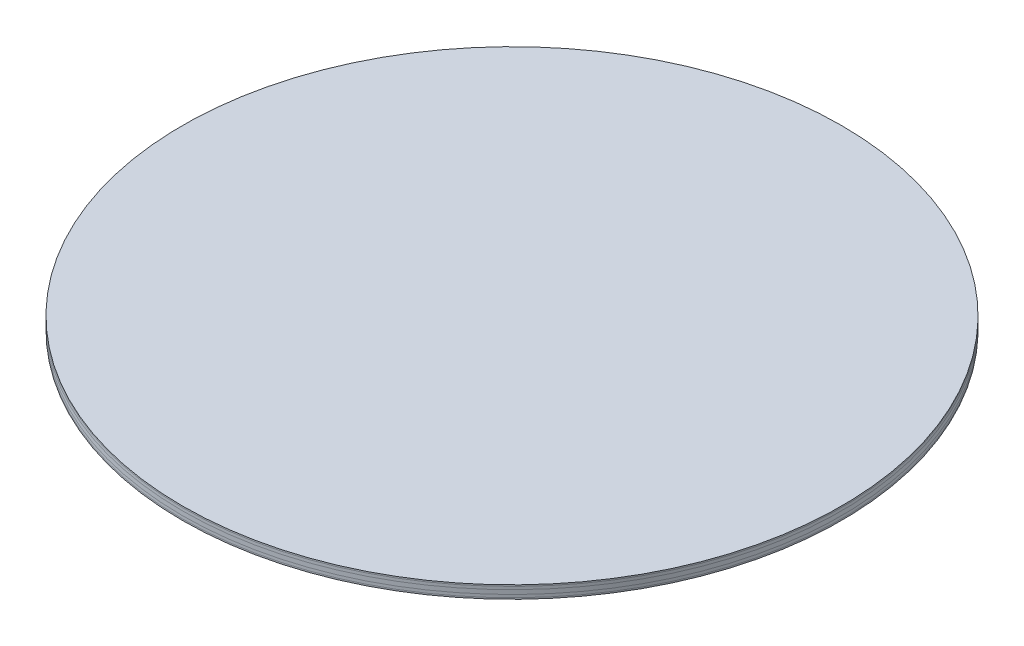
from build123d import *

# Parameters (mm, degrees)
SKETCH3_W                = 1219.2
SKETCH3_H                = 1219.2
BOSS_EXTRUDE1_DEPTH      = 19.05
SPLIT1_SURFACE_1_1_BACK  = 1725.314
SPLIT1_SURFACE_1_1_DEPTH = 3450.628
SPLIT1_SURFACE_1_2_BACK  = 1725.314
SPLIT1_SURFACE_1_2_DEPTH = 3450.628
SPLIT1_SURFACE_2_3_BACK  = 1725.314
SPLIT1_SURFACE_2_3_DEPTH = 3450.628
SPLIT1_SURFACE_2_4_BACK  = 1725.314
SPLIT1_SURFACE_2_4_DEPTH = 3450.628
SPLIT1_SURFACE_3_5_BACK  = 1725.314
SPLIT1_SURFACE_3_5_DEPTH = 3450.628
SPLIT1_SURFACE_3_6_BACK  = 1725.314
SPLIT1_SURFACE_3_6_DEPTH = 3450.628
SPLIT1_SURFACE_4_7_BACK  = 1725.314
SPLIT1_SURFACE_4_7_DEPTH = 3450.628
SPLIT1_SURFACE_4_8_BACK  = 1725.314
SPLIT1_SURFACE_4_8_DEPTH = 3450.628
SKETCH6_W                = 1219.2
SKETCH6_H                = 1219.2
SKETCH6_R                = 500
CUT_EXTRUDE1_DEPTH       = 863.315036689


with BuildPart() as part:
    # Sketch3 → Boss-Extrude1 (new body)
    with BuildSketch(Plane(origin=(0, 0, 0), x_dir=(1, 0, 0), z_dir=(0, 1, 0))):
        Rectangle(SKETCH3_W, SKETCH3_H)
    extrude(amount=-BOSS_EXTRUDE1_DEPTH)


with BuildPart() as body_2:
    # Split1: the piece behind the surface
    add(part.part)
    # Split1 surface 1: a surface, the sketch's curves swept straight by 3450.628 mm
    with BuildLine(Plane.XY.offset(-SPLIT1_SURFACE_1_1_BACK), mode=Mode.PRIVATE) as split1_surface_1_1_path:
        Line((-670.56, -16.933333333), (670.56, -16.933333333))
    split1_surface_1_1 = Shell.extrude(split1_surface_1_1_path.wire(), (0 * SPLIT1_SURFACE_1_1_DEPTH, 0 * SPLIT1_SURFACE_1_1_DEPTH, 1 * SPLIT1_SURFACE_1_1_DEPTH))
    split(bisect_by=split1_surface_1_1, keep=Keep.BOTTOM)


with BuildPart() as part_1:
    add(part.part)

    # Split1: split by a surface, the side it looks to stays
    # Split1 surface 1: a surface, the sketch's curves swept straight by 3450.628 mm
    with BuildLine(Plane.XY.offset(-SPLIT1_SURFACE_1_2_BACK), mode=Mode.PRIVATE) as split1_surface_1_2_path:
        Line((-670.56, -16.933333333), (670.56, -16.933333333))
    split1_surface_1_2 = Shell.extrude(split1_surface_1_2_path.wire(), (0 * SPLIT1_SURFACE_1_2_DEPTH, 0 * SPLIT1_SURFACE_1_2_DEPTH, 1 * SPLIT1_SURFACE_1_2_DEPTH))
    split(bisect_by=split1_surface_1_2, keep=Keep.TOP)


with BuildPart() as body_3:
    # Split1 2: the piece behind the surface
    add(part_1.part)
    # Split1 surface 2: a surface, the sketch's curves swept straight by 3450.628 mm
    with BuildLine(Plane.XY.offset(-SPLIT1_SURFACE_2_3_BACK), mode=Mode.PRIVATE) as split1_surface_2_3_path:
        Line((-670.56, -12.7), (670.56, -12.7))
    split1_surface_2_3 = Shell.extrude(split1_surface_2_3_path.wire(), (0 * SPLIT1_SURFACE_2_3_DEPTH, 0 * SPLIT1_SURFACE_2_3_DEPTH, 1 * SPLIT1_SURFACE_2_3_DEPTH))
    split(bisect_by=split1_surface_2_3, keep=Keep.BOTTOM)


with BuildPart() as part_2:
    add(part_1.part)

    # Split1 2: split by a surface, the side it looks to stays
    # Split1 surface 2: a surface, the sketch's curves swept straight by 3450.628 mm
    with BuildLine(Plane.XY.offset(-SPLIT1_SURFACE_2_4_BACK), mode=Mode.PRIVATE) as split1_surface_2_4_path:
        Line((-670.56, -12.7), (670.56, -12.7))
    split1_surface_2_4 = Shell.extrude(split1_surface_2_4_path.wire(), (0 * SPLIT1_SURFACE_2_4_DEPTH, 0 * SPLIT1_SURFACE_2_4_DEPTH, 1 * SPLIT1_SURFACE_2_4_DEPTH))
    split(bisect_by=split1_surface_2_4, keep=Keep.TOP)


with BuildPart() as body_4_2:
    # Split1 3: the piece behind the surface
    add(part_2.part)
    # Split1 surface 3: a surface, the sketch's curves swept straight by 3450.628 mm
    with BuildLine(Plane.XY.offset(-SPLIT1_SURFACE_3_5_BACK), mode=Mode.PRIVATE) as split1_surface_3_5_path:
        Line((-670.56, -2.116666667), (670.56, -2.116666667))
    split1_surface_3_5 = Shell.extrude(split1_surface_3_5_path.wire(), (0 * SPLIT1_SURFACE_3_5_DEPTH, 0 * SPLIT1_SURFACE_3_5_DEPTH, 1 * SPLIT1_SURFACE_3_5_DEPTH))
    split(bisect_by=split1_surface_3_5, keep=Keep.BOTTOM)


with BuildPart() as part_3:
    add(part_2.part)

    # Split1 3: split by a surface, the side it looks to stays
    # Split1 surface 3: a surface, the sketch's curves swept straight by 3450.628 mm
    with BuildLine(Plane.XY.offset(-SPLIT1_SURFACE_3_6_BACK), mode=Mode.PRIVATE) as split1_surface_3_6_path:
        Line((-670.56, -2.116666667), (670.56, -2.116666667))
    split1_surface_3_6 = Shell.extrude(split1_surface_3_6_path.wire(), (0 * SPLIT1_SURFACE_3_6_DEPTH, 0 * SPLIT1_SURFACE_3_6_DEPTH, 1 * SPLIT1_SURFACE_3_6_DEPTH))
    split(bisect_by=split1_surface_3_6, keep=Keep.TOP)


with BuildPart() as body_5_2:
    # Split1 4 body 4 2: the piece behind the surface
    add(body_4_2.part)
    # Split1 surface 4: a surface, the sketch's curves swept straight by 3450.628 mm
    with BuildLine(Plane.XY.offset(-SPLIT1_SURFACE_4_7_BACK), mode=Mode.PRIVATE) as split1_surface_4_7_path:
        Line((-670.56, -6.35), (670.56, -6.35))
    split1_surface_4_7 = Shell.extrude(split1_surface_4_7_path.wire(), (0 * SPLIT1_SURFACE_4_7_DEPTH, 0 * SPLIT1_SURFACE_4_7_DEPTH, 1 * SPLIT1_SURFACE_4_7_DEPTH))
    split(bisect_by=split1_surface_4_7, keep=Keep.BOTTOM)


with BuildPart() as body_4_2_1:
    add(body_4_2.part)

    # Split1 4 body 4 2: split by a surface, the side it looks to stays
    # Split1 surface 4: a surface, the sketch's curves swept straight by 3450.628 mm
    with BuildLine(Plane.XY.offset(-SPLIT1_SURFACE_4_8_BACK), mode=Mode.PRIVATE) as split1_surface_4_8_path:
        Line((-670.56, -6.35), (670.56, -6.35))
    split1_surface_4_8 = Shell.extrude(split1_surface_4_8_path.wire(), (0 * SPLIT1_SURFACE_4_8_DEPTH, 0 * SPLIT1_SURFACE_4_8_DEPTH, 1 * SPLIT1_SURFACE_4_8_DEPTH))
    split(bisect_by=split1_surface_4_8, keep=Keep.TOP)


with BuildPart() as cut_extrude1_tool:
    # Sketch6 → Cut-Extrude1 (new, through all)
    with BuildSketch(Plane(origin=(0, 0, 0), x_dir=(1, 0, 0), z_dir=(0, 1, 0))):
        Rectangle(SKETCH6_W, SKETCH6_H)
        with Locations(Location((0, 0, 0), (0, 0, 270))):
            Circle(SKETCH6_R, mode=Mode.SUBTRACT)
    extrude(amount=-CUT_EXTRUDE1_DEPTH)


with BuildPart() as part_4:
    add(part_3.part)

    # Cut-Extrude1: cut by cut_extrude1_tool
    add(cut_extrude1_tool.part, mode=Mode.SUBTRACT)


with BuildPart() as body_2_1:
    add(body_2.part)

    # Cut-Extrude1: cut by cut_extrude1_tool
    add(cut_extrude1_tool.part, mode=Mode.SUBTRACT)


with BuildPart() as body_3_1:
    add(body_3.part)

    # Cut-Extrude1: cut by cut_extrude1_tool
    add(cut_extrude1_tool.part, mode=Mode.SUBTRACT)


with BuildPart() as body_4_2_2:
    add(body_4_2_1.part)

    # Cut-Extrude1: cut by cut_extrude1_tool
    add(cut_extrude1_tool.part, mode=Mode.SUBTRACT)


with BuildPart() as body_5_2_1:
    add(body_5_2.part)

    # Cut-Extrude1: cut by cut_extrude1_tool
    add(cut_extrude1_tool.part, mode=Mode.SUBTRACT)


solid = Compound([part_4.part, body_2_1.part, body_3_1.part, body_4_2_2.part, body_5_2_1.part])
